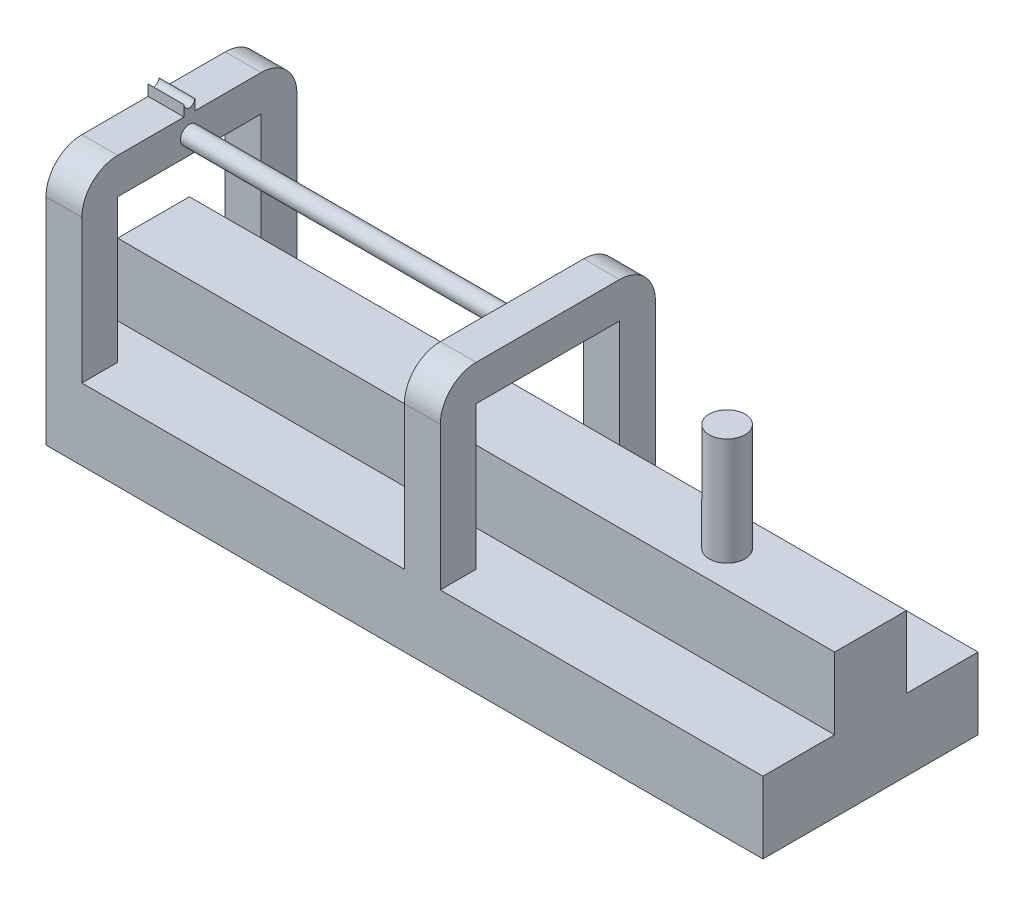
from build123d import *

# Parameters (mm, degrees)
EXTRUDE_1_DEPTH = 200
EXTRUDE_2_DEPTH = 10
EXTRUDE_3_DEPTH = 10
FILLET_1_R      = 10
EXTRUDE_4_REACH = 206.695
SKETCH_4_R      = 2.5
SKETCH_5_R      = 5
EXTRUDE_5_DEPTH = 30
EXTRUDE_6_DEPTH = 10


with BuildPart() as part:
    # 스케치1 → 보스-돌출1 (new body)
    with BuildSketch(Plane(origin=(0, 0, 0), x_dir=(0, 0, -1), z_dir=(1, 0, 0))):
        Polygon((30, 0), (-30, 0), (-30, 20), (-10, 20), (-10, 40), (10, 40), (10, 20), (30, 20), align=None)
    extrude(amount=EXTRUDE_1_DEPTH)

    # 스케치2 → 보스-돌출2 (add)
    with BuildSketch(Plane.ZY):
        Polygon((-30, 20), (-20, 20), (-20, 60), (20, 60), (20, 20), (30, 20), (30, 70), (-30, 70), align=None)
    extrude(amount=-EXTRUDE_2_DEPTH)

    # 스케치3 → 보스-돌출3 (add)
    with BuildSketch(Plane.ZY.offset(-100)):
        Polygon((20, 20), (30, 20), (30, 70), (-30, 70), (-30, 20), (-20, 20), (-20, 60), (20, 60), align=None)
    extrude(amount=-EXTRUDE_3_DEPTH)

    # 필렛1
    fillet_1_edges = [part.edges().sort_by_distance(p)[0] for p in [
        (5, 70, -30),
        (5, 70, 30),
        (105, 70, -30),
        (105, 70, 30),
    ]]
    fillet(fillet_1_edges, radius=FILLET_1_R)

    # 스케치4 → 보스-돌출4 (add, up to next)
    with BuildSketch(Plane(origin=(10, 0, 0), x_dir=(0, 0, -1), z_dir=(1, 0, 0)), mode=Mode.PRIVATE) as extrude_4_sk1:
        with Locations((0, 65)):
            Circle(SKETCH_4_R)
    extrude_4_tool1 = extrude(extrude_4_sk1.sketch, amount=EXTRUDE_4_REACH, mode=Mode.PRIVATE) - part.part
    add(extrude_4_tool1.solids().sort_by_distance((10, 65, 0))[0])

    # 스케치5 → 보스-돌출5 (add)
    with BuildSketch(Plane(origin=(0, 40, 0), x_dir=(1, 0, 0), z_dir=(0, 1, 0))):
        with Locations(Location((160, 0, 0), (0, 0, 90))):
            Circle(SKETCH_5_R)
    extrude(amount=EXTRUDE_5_DEPTH)

    # 스케치6 → 보스-돌출6 (add)
    with BuildSketch(Plane.ZY):
        with BuildLine():
            Line((-1.5, 73), (-1.5, 70))
            Line((-1.5, 70), (1.5, 70))
            Line((1.5, 70), (1.5, 73))
            ThreePointArc((1.5, 73), (0, 71.5), (-1.5, 73))
        make_face()
    extrude(amount=-EXTRUDE_6_DEPTH)


solid = part.part
